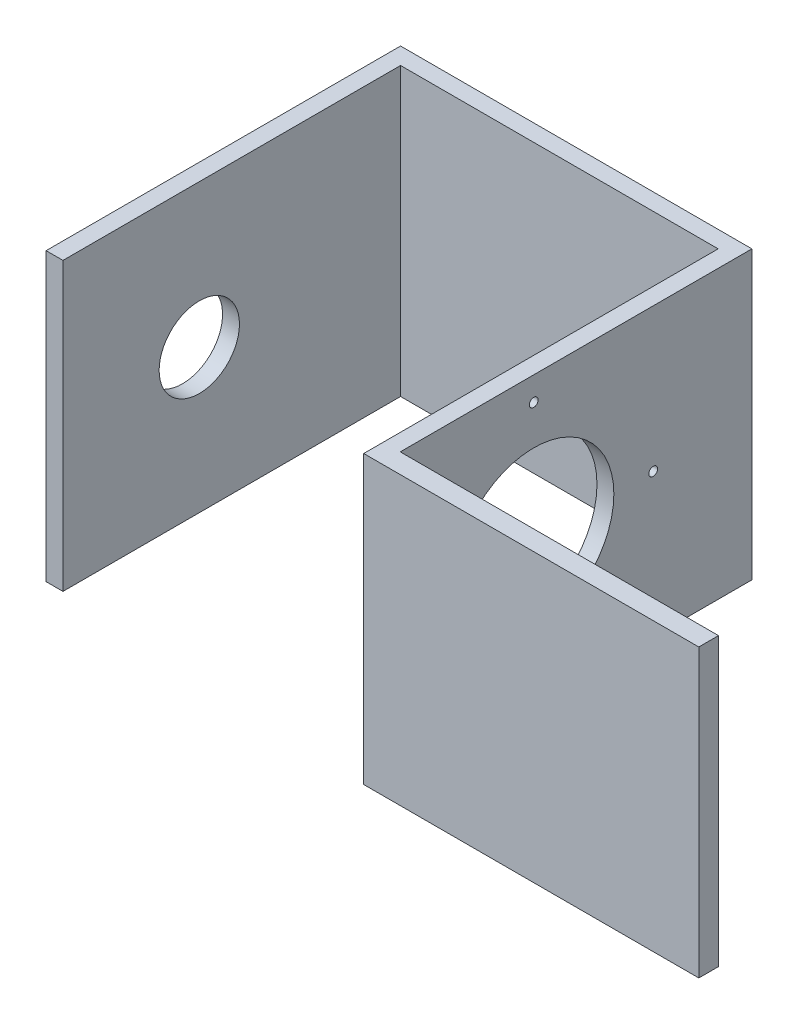
from build123d import *

# Parameters (mm, degrees)
BOSS_EXTRUDE3_DEPTH      = 51
BOSS_EXTRUDE3_DEPTH_BACK = 51
CUT_EXTRUDE3_REACH       = 157.723
SKETCH7_R                = 1.5635
SKETCH7_R_2              = 28.5
CUT_EXTRUDE4_REACH       = 257.685
SKETCH8_R                = 14.2875


with BuildPart() as part:
    # Sketch6 → Boss-Extrude3 (new, two sides: drawn at the far end of the back side and taken through both)
    with BuildSketch(Plane(origin=(0, 0, 0), x_dir=(1, 0, 0), z_dir=(0, 1, 0)).offset(-BOSS_EXTRUDE3_DEPTH_BACK)):
        Polygon((175.723, -47.5), (175.723, -54.5), (56.5, -54.5), (56.5, 71.6115), (-56.5, 71.6115), (-56.5, -48.5), (-62.5, -48.5), (-62.5, 77.6115), (62.5, 77.6115), (62.5, -47.5), align=None)
    extrude(amount=BOSS_EXTRUDE3_DEPTH + BOSS_EXTRUDE3_DEPTH_BACK)

    # Sketch7 → Cut-Extrude3 (cut, up to next)
    with BuildSketch(Plane(origin=(62.5, 0, 0), x_dir=(0, 0, -1), z_dir=(1, 0, 0)), mode=Mode.PRIVATE) as cut_extrude3_sk1:
        with Locations((0, 42.5)):
            Circle(SKETCH7_R)
    cut_extrude3_tool1 = extrude(cut_extrude3_sk1.sketch, amount=-CUT_EXTRUDE3_REACH, mode=Mode.PRIVATE) & part.part
    # Sketch7 → Cut-Extrude3 (cut, up to next)
    with BuildSketch(Plane(origin=(62.5, 0, 0), x_dir=(0, 0, -1), z_dir=(1, 0, 0)), mode=Mode.PRIVATE) as cut_extrude3_sk2:
        with Locations((42.5, 0)):
            Circle(SKETCH7_R)
    cut_extrude3_tool2 = extrude(cut_extrude3_sk2.sketch, amount=-CUT_EXTRUDE3_REACH, mode=Mode.PRIVATE) & part.part
    # Sketch7 → Cut-Extrude3 (cut, up to next)
    with BuildSketch(Plane(origin=(62.5, 0, 0), x_dir=(0, 0, -1), z_dir=(1, 0, 0)), mode=Mode.PRIVATE) as cut_extrude3_sk3:
        with Locations((0, -42.5)):
            Circle(SKETCH7_R)
    cut_extrude3_tool3 = extrude(cut_extrude3_sk3.sketch, amount=-CUT_EXTRUDE3_REACH, mode=Mode.PRIVATE) & part.part
    # Sketch7 → Cut-Extrude3 (cut, up to next)
    with BuildSketch(Plane(origin=(62.5, 0, 0), x_dir=(0, 0, -1), z_dir=(1, 0, 0)), mode=Mode.PRIVATE) as cut_extrude3_sk4:
        with Locations((-42.5, 0)):
            Circle(SKETCH7_R)
    cut_extrude3_tool4 = extrude(cut_extrude3_sk4.sketch, amount=-CUT_EXTRUDE3_REACH, mode=Mode.PRIVATE) & part.part
    # Sketch7 → Cut-Extrude3 (cut, up to next)
    with BuildSketch(Plane(origin=(62.5, 0, 0), x_dir=(0, 0, -1), z_dir=(1, 0, 0)), mode=Mode.PRIVATE) as cut_extrude3_sk5:
        Circle(SKETCH7_R_2)
    cut_extrude3_tool5 = extrude(cut_extrude3_sk5.sketch, amount=-CUT_EXTRUDE3_REACH, mode=Mode.PRIVATE) & part.part
    add(cut_extrude3_tool1.solids().sort_by_distance((62.5, 42.5, 0))[0], mode=Mode.SUBTRACT)
    add(cut_extrude3_tool2.solids().sort_by_distance((62.5, 0, -42.5))[0], mode=Mode.SUBTRACT)
    add(cut_extrude3_tool3.solids().sort_by_distance((62.5, -42.5, 0))[0], mode=Mode.SUBTRACT)
    add(cut_extrude3_tool4.solids().sort_by_distance((62.5, 0, 42.5))[0], mode=Mode.SUBTRACT)
    add(cut_extrude3_tool5.solids().sort_by_distance((62.5, 0, 0))[0], mode=Mode.SUBTRACT)

    # Sketch8 → Cut-Extrude4 (cut, up to next)
    with BuildSketch(Plane.ZY.offset(62.5), mode=Mode.PRIVATE) as cut_extrude4_sk1:
        Circle(SKETCH8_R)
    cut_extrude4_tool1 = extrude(cut_extrude4_sk1.sketch, amount=-CUT_EXTRUDE4_REACH, mode=Mode.PRIVATE) & part.part
    add(cut_extrude4_tool1.solids().sort_by_distance((-62.5, 0, 0))[0], mode=Mode.SUBTRACT)


solid = part.part
